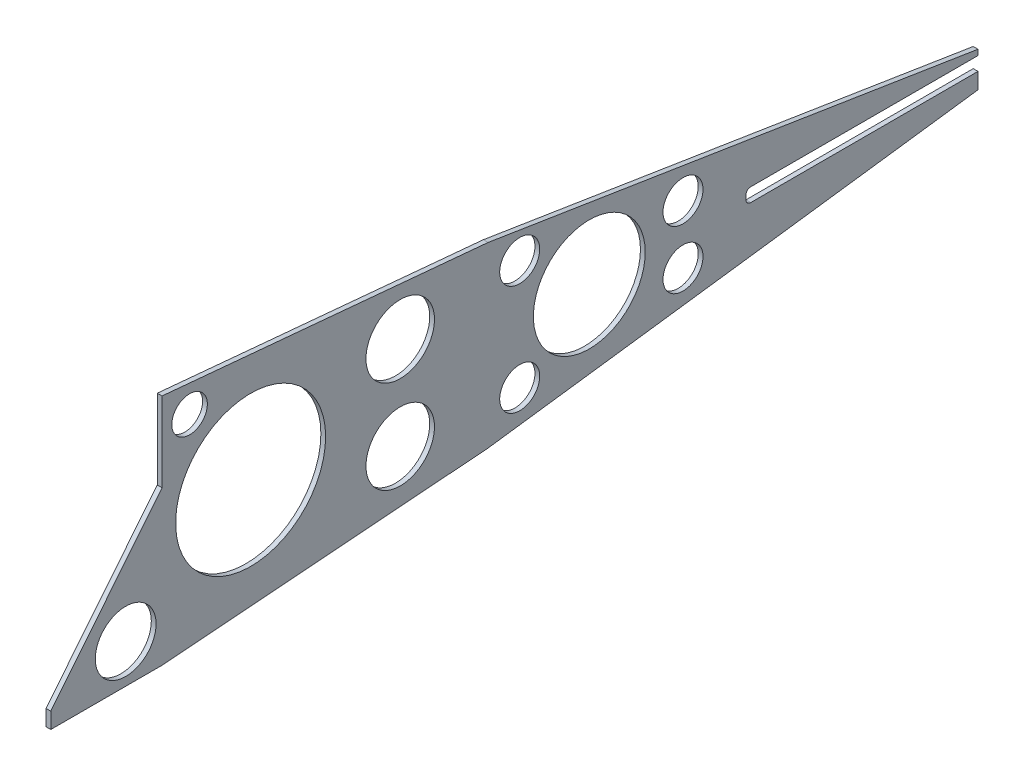
from build123d import *

# Parameters (mm, degrees)
BOSS_EXTRUDE1_DEPTH      = 1.5
BOSS_EXTRUDE1_DEPTH_BACK = 1.5
SKETCH3_W                = 152
SKETCH3_H                = 8.6
CUT_EXTRUDE1_DEPTH       = 520.533194562
FILLET1_R                = 3
SKETCH4_R                = 19.119387796
SKETCH4_R_2              = 47.191393473
SKETCH4_R_3              = 35.18699184
SKETCH4_R_4              = 12.586978738
SKETCH4_R_5              = 11.189603354
SKETCH4_R_6              = 21.557380713
CUT_EXTRUDE2_DEPTH       = 10


with BuildPart() as part:
    # Sketch2 → Boss-Extrude1 (new, two sides: drawn at the far end of the back side and taken through both)
    with BuildSketch(Plane(origin=(0, 0, 0), x_dir=(0, 0, -1), z_dir=(1, 0, 0)).offset(-BOSS_EXTRUDE1_DEPTH_BACK)):
        Polygon((0, 67.22485033), (205.165503831, 48.288859026), (513.4, -0.530689138), (513.4, -22.650154351), (205.250409944, -63.717607751), (0, -79.537288439), (-70, -79.537288439), (-70, -69.537288439), (0, 17.22485033), align=None)
    extrude(amount=BOSS_EXTRUDE1_DEPTH + BOSS_EXTRUDE1_DEPTH_BACK)

    # Sketch3 → Cut-Extrude1 (cut, through all)
    with BuildSketch(Plane(origin=(1.5, 0, 0), x_dir=(0, 0, -1), z_dir=(1, 0, 0))):
        with Locations((443.4, -8.3)):
            Rectangle(SKETCH3_W, SKETCH3_H)
    extrude(amount=-CUT_EXTRUDE1_DEPTH, mode=Mode.SUBTRACT)

    # Fillet1
    fillet1_edges = [part.edges().sort_by_distance(p)[0] for p in [
        (0, -4, -367.4),
        (0, -12.6, -367.4),
    ]]
    fillet(fillet1_edges, radius=FILLET1_R)

    # Sketch4 → Cut-Extrude2 (cut)
    with BuildSketch(Plane(origin=(1.5, 0, 0), x_dir=(0, 0, -1), z_dir=(1, 0, 0))):
        with Locations((-22.865600385, -55.069339131)):
            Circle(SKETCH4_R)
        with Locations((55.752747866, -6.379566635)):
            Circle(SKETCH4_R_2)
        with Locations((268.826339435, -6.379566635)):
            Circle(SKETCH4_R_3)
        with Locations((225.050213704, 28.462655886)):
            Circle(SKETCH4_R_4)
        with Locations((17.336964062, 48.563938109)):
            Circle(SKETCH4_R_5)
        with Locations((225.050213704, -40.775093995)):
            Circle(SKETCH4_R_4)
        with Locations((327.790100624, -26.927544019)):
            Circle(SKETCH4_R_4)
        with Locations((327.790100624, 9.701459144)):
            Circle(SKETCH4_R_4)
        with Locations((149.867646424, 23.293890716)):
            Circle(SKETCH4_R_6)
        with Locations((149.867646424, -35.180680846)):
            Circle(SKETCH4_R_6)
    extrude(amount=-CUT_EXTRUDE2_DEPTH, mode=Mode.SUBTRACT)


solid = part.part
